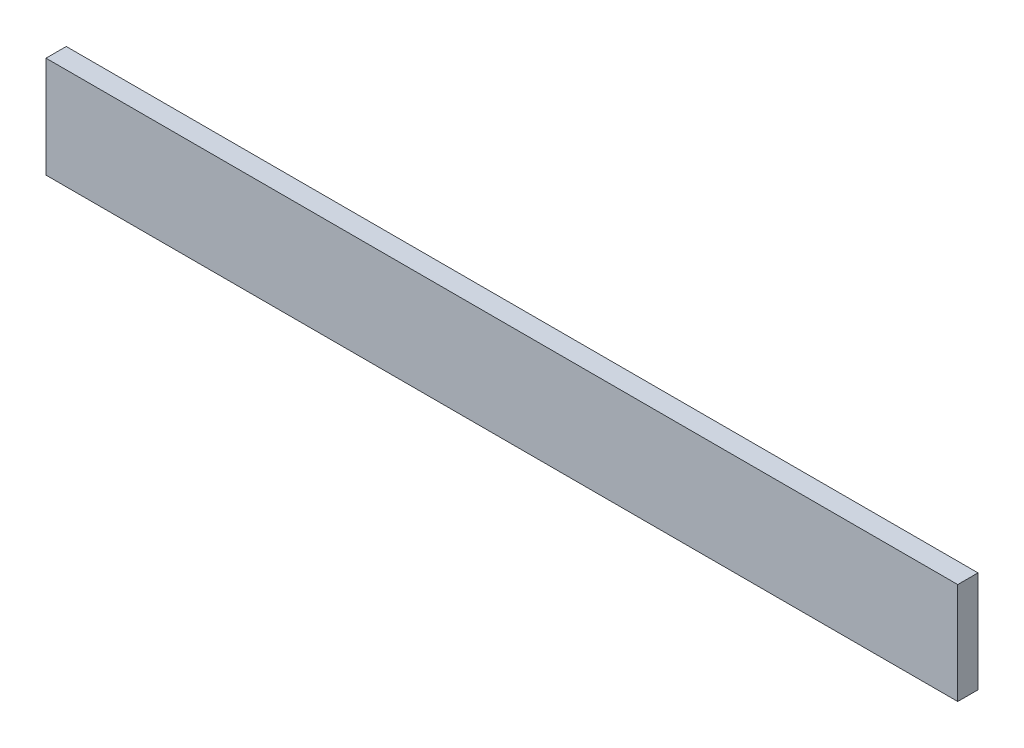
from build123d import *

# Parameters (mm, degrees)
SKETCH1_W           = 900
SKETCH1_H           = 100
BOSS_EXTRUDE1_DEPTH = 20
SKETCH2_R           = 9.7
SKETCH2_R_2         = 4.826
BOSS_EXTRUDE2_DEPTH = 15.8


with BuildPart() as part:
    # Sketch1 → Boss-Extrude1 (new body)
    with BuildSketch(Plane.XY):
        Rectangle(SKETCH1_W, SKETCH1_H)
    extrude(amount=BOSS_EXTRUDE1_DEPTH)

    # Sketch2 → Boss-Extrude2 (add)
    # profile 1 of 3: a face of its own
    with BuildSketch(Plane.XY):
        with Locations((-300, -30.95)):
            Circle(SKETCH2_R)
        with Locations((-300, -30.95)):
            Circle(SKETCH2_R_2, mode=Mode.SUBTRACT)
    # profile 2 of 3: a face of its own
    with BuildSketch(Plane.XY):
        with Locations((0, -30.95)):
            Circle(SKETCH2_R)
        with Locations((0, -30.95)):
            Circle(SKETCH2_R_2, mode=Mode.SUBTRACT)
    # profile 3 of 3: a face of its own
    with BuildSketch(Plane.XY):
        with Locations((300, -30.95)):
            Circle(SKETCH2_R)
        with Locations((300, -30.95)):
            Circle(SKETCH2_R_2, mode=Mode.SUBTRACT)
    extrude(amount=-BOSS_EXTRUDE2_DEPTH)


solid = part.part
